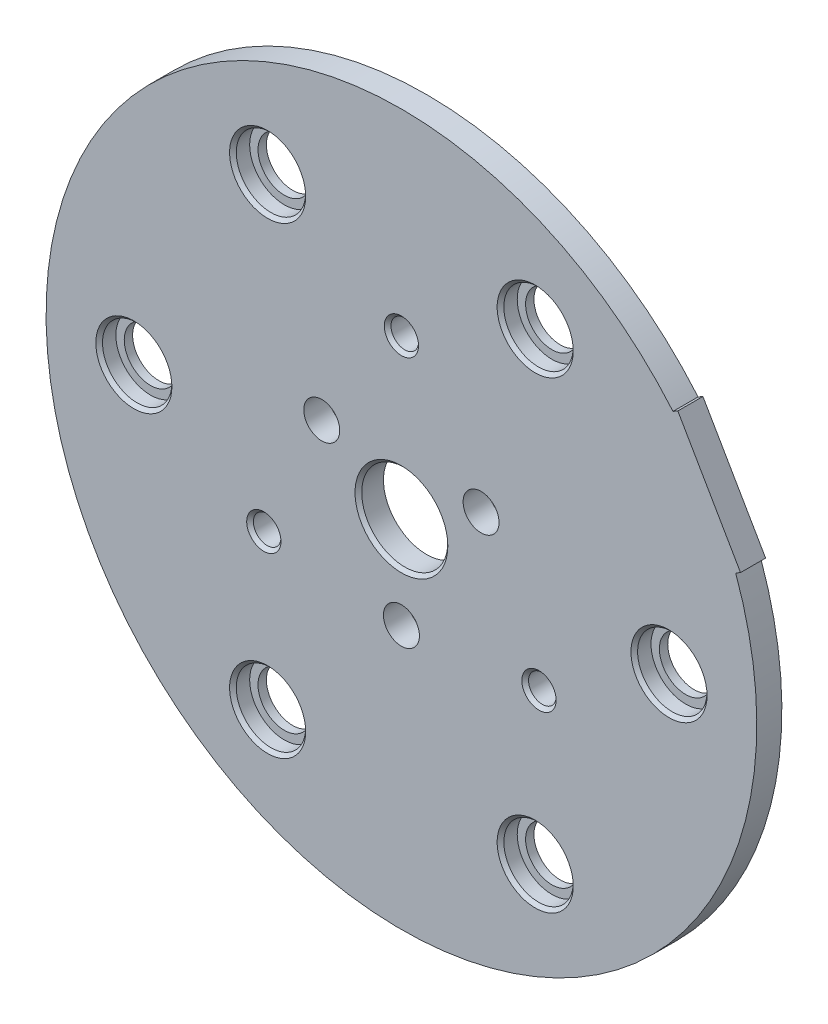
from build123d import *

# Parameters (mm, degrees)
SKETCH_1_R          = 42.5
EXTRUDE_1_DEPTH     = 3
SKETCH_2_R          = 4.15
CUT_EXTRUDE_1_DEPTH = 61.178899957
SKETCH_3_R          = 5.15
CUT_EXTRUDE_2_DEPTH = 61.178899957
EXTRUDE_START       = -1
SKETCH_4_R          = 4.15
SKETCH_4_R_2        = 3.15
EXTRUDE_1_2_DEPTH   = 1
CUT_EXTRUDE_3_REACH = 62.179
SKETCH_5_R          = 1.65
CUT_EXTRUDE_4_REACH = 62.179
SKETCH_7_R          = 2.15
CHAMFER_2_SIZE      = 0.4
EXTRUDE_START_2     = -3
EXTRUDE_3_DEPTH     = 3


with BuildPart() as part:
    # 草图1 → Extrude 1 (new body)
    with BuildSketch(Plane.XY):
        Circle(SKETCH_1_R)
    extrude(amount=-EXTRUDE_1_DEPTH)

    # 草图2 → 切除-拉伸1 (cut, through all)
    with BuildSketch(Plane.XY):
        with Locations((-32, 0)):
            Circle(SKETCH_2_R)
        with Locations((-16, 27.712812921)):
            Circle(SKETCH_2_R)
        with Locations((16, 27.712812921)):
            Circle(SKETCH_2_R)
        with Locations((32, 0)):
            Circle(SKETCH_2_R)
        with Locations((16, -27.712812921)):
            Circle(SKETCH_2_R)
        with Locations((-16, -27.712812921)):
            Circle(SKETCH_2_R)
    extrude(amount=-CUT_EXTRUDE_1_DEPTH, mode=Mode.SUBTRACT)

    # 草图3 → 切除-拉伸2 (cut, through all)
    with BuildSketch(Plane.XY):
        Circle(SKETCH_3_R)
    extrude(amount=-CUT_EXTRUDE_2_DEPTH, mode=Mode.SUBTRACT)

    # 草图4 → Extrude 1 2 (add)
    # profile 1 of 6: a face of its own
    with BuildSketch(Plane(origin=(0, 0, -3), x_dir=(-1, 0, 0), z_dir=(0, 0, -1)).offset(EXTRUDE_START)):
        with Locations((-16, 27.712812921)):
            Circle(SKETCH_4_R)
        with Locations((-16, 27.712812921)):
            Circle(SKETCH_4_R_2, mode=Mode.SUBTRACT)
    # profile 2 of 6: a face of its own
    with BuildSketch(Plane(origin=(0, 0, -3), x_dir=(-1, 0, 0), z_dir=(0, 0, -1)).offset(EXTRUDE_START)):
        with Locations((16, 27.712812921)):
            Circle(SKETCH_4_R)
        with Locations((16, 27.712812921)):
            Circle(SKETCH_4_R_2, mode=Mode.SUBTRACT)
    # profile 3 of 6: a face of its own
    with BuildSketch(Plane(origin=(0, 0, -3), x_dir=(-1, 0, 0), z_dir=(0, 0, -1)).offset(EXTRUDE_START)):
        with Locations((32, 0)):
            Circle(SKETCH_4_R)
        with Locations((32, 0)):
            Circle(SKETCH_4_R_2, mode=Mode.SUBTRACT)
    # profile 4 of 6: a face of its own
    with BuildSketch(Plane(origin=(0, 0, -3), x_dir=(-1, 0, 0), z_dir=(0, 0, -1)).offset(EXTRUDE_START)):
        with Locations((16, -27.712812921)):
            Circle(SKETCH_4_R)
        with Locations((16, -27.712812921)):
            Circle(SKETCH_4_R_2, mode=Mode.SUBTRACT)
    # profile 5 of 6: a face of its own
    with BuildSketch(Plane(origin=(0, 0, -3), x_dir=(-1, 0, 0), z_dir=(0, 0, -1)).offset(EXTRUDE_START)):
        with Locations((-16, -27.712812921)):
            Circle(SKETCH_4_R)
        with Locations((-16, -27.712812921)):
            Circle(SKETCH_4_R_2, mode=Mode.SUBTRACT)
    # profile 6 of 6: a face of its own
    with BuildSketch(Plane(origin=(0, 0, -3), x_dir=(-1, 0, 0), z_dir=(0, 0, -1)).offset(EXTRUDE_START)):
        with Locations((-32, 0)):
            Circle(SKETCH_4_R)
        with Locations((-32, 0)):
            Circle(SKETCH_4_R_2, mode=Mode.SUBTRACT)
    extrude(amount=EXTRUDE_1_2_DEPTH)

    # 草图5 → 切除-拉伸3 (cut, up to next)
    with BuildSketch(Plane(origin=(0, 0, -3), x_dir=(-1, 0, 0), z_dir=(0, 0, -1)), mode=Mode.PRIVATE) as cut_extrude_3_sk1:
        with Locations((-16.454482672, -9.5)):
            Circle(SKETCH_5_R)
    cut_extrude_3_tool1 = extrude(cut_extrude_3_sk1.sketch, amount=-CUT_EXTRUDE_3_REACH, mode=Mode.PRIVATE) & part.part
    # 草图5 → 切除-拉伸3 (cut, up to next)
    with BuildSketch(Plane(origin=(0, 0, -3), x_dir=(-1, 0, 0), z_dir=(0, 0, -1)), mode=Mode.PRIVATE) as cut_extrude_3_sk2:
        with Locations((0, 19)):
            Circle(SKETCH_5_R)
    cut_extrude_3_tool2 = extrude(cut_extrude_3_sk2.sketch, amount=-CUT_EXTRUDE_3_REACH, mode=Mode.PRIVATE) & part.part
    # 草图5 → 切除-拉伸3 (cut, up to next)
    with BuildSketch(Plane(origin=(0, 0, -3), x_dir=(-1, 0, 0), z_dir=(0, 0, -1)), mode=Mode.PRIVATE) as cut_extrude_3_sk3:
        with Locations((16.454482672, -9.5)):
            Circle(SKETCH_5_R)
    cut_extrude_3_tool3 = extrude(cut_extrude_3_sk3.sketch, amount=-CUT_EXTRUDE_3_REACH, mode=Mode.PRIVATE) & part.part
    add(cut_extrude_3_tool1.solids().sort_by_distance((16.454483, -9.5, -3))[0], mode=Mode.SUBTRACT)
    add(cut_extrude_3_tool2.solids().sort_by_distance((0, 19, -3))[0], mode=Mode.SUBTRACT)
    add(cut_extrude_3_tool3.solids().sort_by_distance((-16.454483, -9.5, -3))[0], mode=Mode.SUBTRACT)

    # 草图7 → 切除-拉伸4 (cut, up to next)
    with BuildSketch(Plane.XY, mode=Mode.PRIVATE) as cut_extrude_4_sk1:
        with Locations((9.526279442, 5.5)):
            Circle(SKETCH_7_R)
    cut_extrude_4_tool1 = extrude(cut_extrude_4_sk1.sketch, amount=-CUT_EXTRUDE_4_REACH, mode=Mode.PRIVATE) & part.part
    # 草图7 → 切除-拉伸4 (cut, up to next)
    with BuildSketch(Plane.XY, mode=Mode.PRIVATE) as cut_extrude_4_sk2:
        with Locations((0, -11)):
            Circle(SKETCH_7_R)
    cut_extrude_4_tool2 = extrude(cut_extrude_4_sk2.sketch, amount=-CUT_EXTRUDE_4_REACH, mode=Mode.PRIVATE) & part.part
    # 草图7 → 切除-拉伸4 (cut, up to next)
    with BuildSketch(Plane.XY, mode=Mode.PRIVATE) as cut_extrude_4_sk3:
        with Locations((-9.526279442, 5.5)):
            Circle(SKETCH_7_R)
    cut_extrude_4_tool3 = extrude(cut_extrude_4_sk3.sketch, amount=-CUT_EXTRUDE_4_REACH, mode=Mode.PRIVATE) & part.part
    add(cut_extrude_4_tool1.solids().sort_by_distance((9.526279, 5.5, 0))[0], mode=Mode.SUBTRACT)
    add(cut_extrude_4_tool2.solids().sort_by_distance((0, -11, 0))[0], mode=Mode.SUBTRACT)
    add(cut_extrude_4_tool3.solids().sort_by_distance((-9.526279, 5.5, 0))[0], mode=Mode.SUBTRACT)

    # 倒角2
    chamfer_2_edges = [part.edges().sort_by_distance(p)[0] for p in [
        (-36.15, 0, 0),
        (-20.15, -27.712812921, 0),
        (11.85, -27.712812921, 0),
        (27.85, 0, 0),
        (11.85, 27.712812921, 0),
        (-20.15, 27.712812921, 0),
        (-5.15, 0, 0),
        (18.104482672, -9.5, 0),
        (1.65, 19, 0),
        (-14.804482672, -9.5, 0),
    ]]
    chamfer(chamfer_2_edges, length=CHAMFER_2_SIZE)

    # 草图8 → 拉伸-薄壁3 (add)
    with BuildSketch(Plane.XY.offset(EXTRUDE_START_2)):
        Polygon((33.056079661, 27.745190528), (40.556079661, 14.754809472), (39.690054257, 14.254809472), (32.190054257, 27.245190528), align=None)
    extrude(amount=EXTRUDE_3_DEPTH)


solid = part.part
